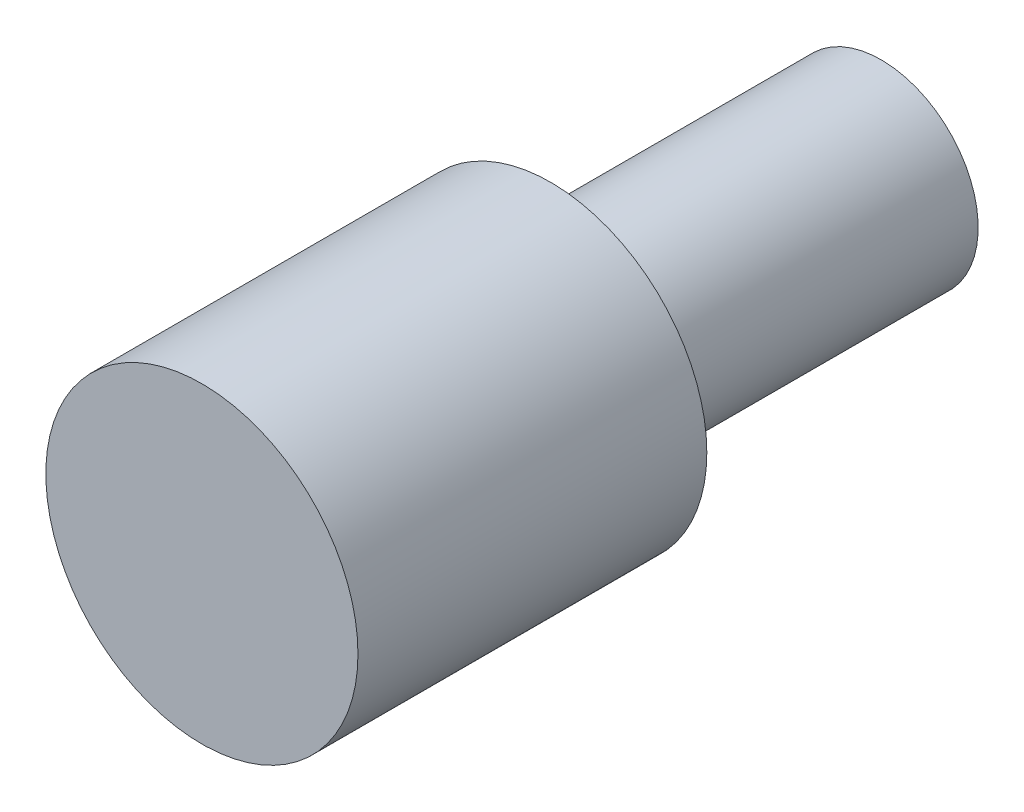
from build123d import *

# Parameters (mm, degrees)
SKETCH_1_R          = 7.65
EXTRUDE_1_DEPTH     = 17.1
SKETCH_3_R          = 4.75
EXTRUDE_2_DEPTH     = 16.2
SKETCH_4_R          = 3.5
CUT_EXTRUDE_1_DEPTH = 16.2


with BuildPart() as part:
    # 草图1 → 凸台-拉伸1 (new body)
    with BuildSketch(Plane.XY):
        Circle(SKETCH_1_R)
    extrude(amount=EXTRUDE_1_DEPTH)

    # 草图3 → 凸台-拉伸2 (add)
    with BuildSketch(Plane(origin=(0, 0, 0), x_dir=(-1, 0, 0), z_dir=(0, 0, -1))):
        Circle(SKETCH_3_R)
    extrude(amount=EXTRUDE_2_DEPTH)

    # 草图4 → 切除-拉伸1 (cut)
    with BuildSketch(Plane(origin=(0, 0, -16.2), x_dir=(-1, 0, 0), z_dir=(0, 0, -1))):
        Circle(SKETCH_4_R)
    extrude(amount=-CUT_EXTRUDE_1_DEPTH, mode=Mode.SUBTRACT)


solid = part.part
